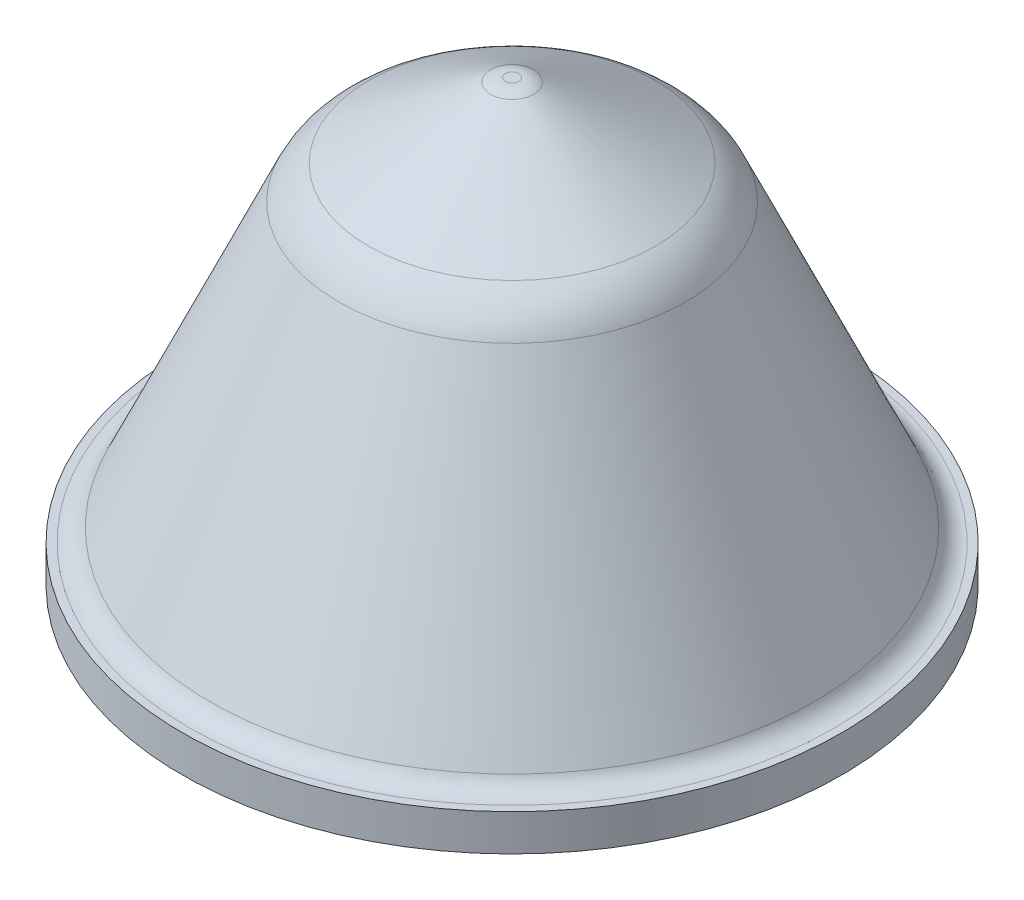
from build123d import *

# Parameters (mm, degrees)
RACCORDO1_R                = 3
FORO_FILETTATO_M10_1_D     = 8.5
FORO_FILETTATO_M10_1_DEPTH = 27.5
FORO_FILETTATO_M10_1_TIP   = 2.553657631
RACCORDO2_R                = 10
RACCORDO3_R                = 4


with BuildPart() as part:
    # Schizzo1 → Rivoluzione1 (revolve)
    with BuildSketch(Plane(origin=(0, 0, 0), x_dir=(0, 0, -1), z_dir=(1, 0, 0)), mode=Mode.PRIVATE) as rivoluzione1_sk:
        Polygon((0, 0), (-45, 0), (-45, 5), (-42, 5), (-22.374431335, 48.236816584), (-2, 60), (0, 60), align=None)
    revolve(rivoluzione1_sk.sketch.rotate(Axis((0, 0, 0), (0, 1, 0)), 180), axis=Axis((0, 0, 0), (0, 1, 0)))

    # Raccordo1
    raccordo1_edges = [part.edges().sort_by_distance(p)[0] for p in [
        (0, 5, 42),
    ]]
    fillet(raccordo1_edges, radius=RACCORDO1_R)

    # Foro filettato M10-1
    with Locations(Plane.XZ):
        with Locations((0, 0)):
            Hole(FORO_FILETTATO_M10_1_D / 2, depth=FORO_FILETTATO_M10_1_DEPTH)
            with Locations((0, 0, -(FORO_FILETTATO_M10_1_DEPTH + FORO_FILETTATO_M10_1_TIP / 2))):  # 118° drill point
                Cone(0, FORO_FILETTATO_M10_1_D / 2, FORO_FILETTATO_M10_1_TIP, mode=Mode.SUBTRACT)

    # Raccordo2
    raccordo2_edges = [part.edges().sort_by_distance(p)[0] for p in [
        (0, 48.236816584, 22.374431335),
    ]]
    fillet(raccordo2_edges, radius=RACCORDO2_R)

    # Raccordo3
    raccordo3_edges = [part.edges().sort_by_distance(p)[0] for p in [
        (0, 60, 2),
    ]]
    fillet(raccordo3_edges, radius=RACCORDO3_R)


solid = part.part
